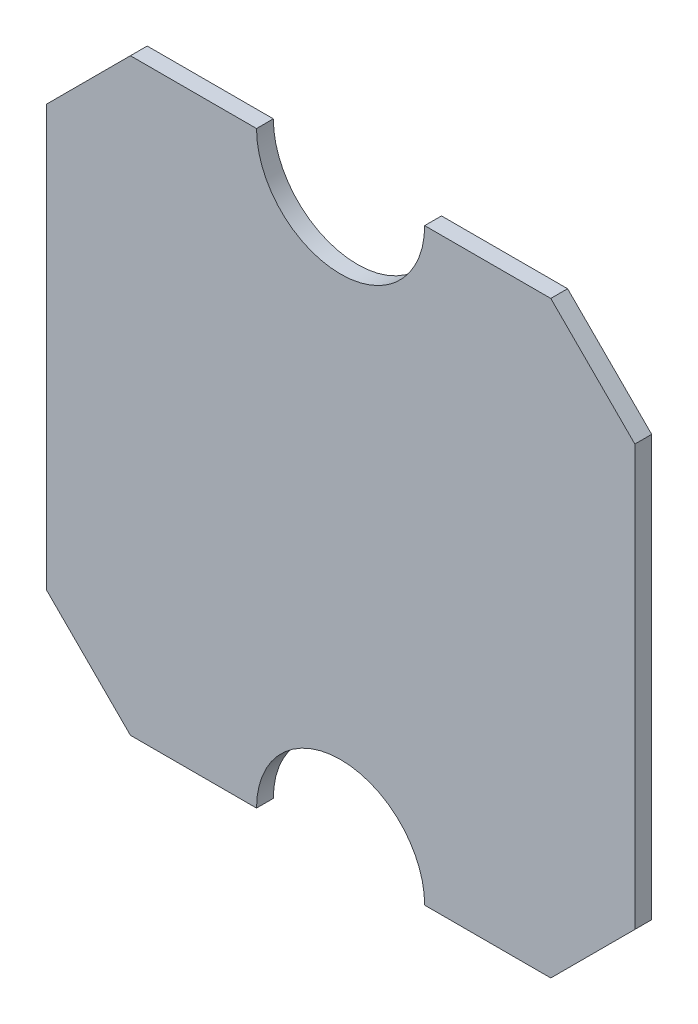
from build123d import *

# Parameters (mm, degrees)
BOSS_EXTRUDE1_DEPTH = 10


with BuildPart() as part:
    # Sketch1 → Boss-Extrude1 (new body)
    with BuildSketch(Plane.XY):
        with BuildLine():
            Line((50, -175), (125, -175))
            Line((125, -175), (175, -125))
            Line((175, -125), (175, 125))
            Line((175, 125), (125, 175))
            Line((125, 175), (50, 175))
            ThreePointArc((50, 175), (0, 125), (-50, 175))
            Line((-50, 175), (-125, 175))
            Line((-125, 175), (-175, 125))
            Line((-175, 125), (-175, -125))
            Line((-175, -125), (-125, -175))
            Line((-125, -175), (-50, -175))
            ThreePointArc((-50, -175), (0, -125), (50, -175))
        make_face()
    extrude(amount=BOSS_EXTRUDE1_DEPTH)


solid = part.part
